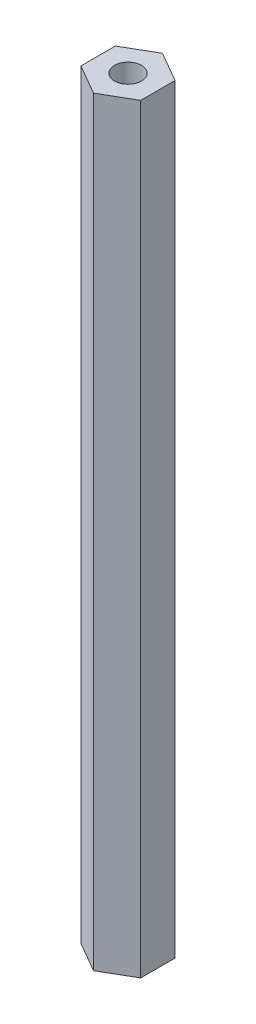
from build123d import *

# Parameters (mm, degrees)
BOSS_EXTRUDE1_DEPTH       = 70
M3X0_5_TAPPED_HOLE1_D     = 2.5
M3X0_5_TAPPED_HOLE1_DEPTH = 7.5
M3X0_5_TAPPED_HOLE1_TIP   = 0.751075774
M3X0_5_TAPPED_HOLE2_D     = 2.5
M3X0_5_TAPPED_HOLE2_DEPTH = 7.5
M3X0_5_TAPPED_HOLE2_TIP   = 0.751075774


with BuildPart() as part:
    # Sketch1 → Boss-Extrude1 (new body)
    with BuildSketch(Plane(origin=(0, 0, 0), x_dir=(1, 0, 0), z_dir=(0, 1, 0))):
        Polygon((-2.75, 1.58771324), (-2.75, -1.58771324), (0, -3.175426481), (2.75, -1.58771324), (2.75, 1.58771324), (0, 3.175426481), align=None)
    extrude(amount=BOSS_EXTRUDE1_DEPTH)

    # M3x0.5 Tapped Hole1
    with Locations(Plane(origin=(0, 0, 0), x_dir=(-1, 0, 0), z_dir=(0, -1, 0))):
        with Locations((0, 0)):
            Hole(M3X0_5_TAPPED_HOLE1_D / 2, depth=M3X0_5_TAPPED_HOLE1_DEPTH)
            with Locations((0, 0, -(M3X0_5_TAPPED_HOLE1_DEPTH + M3X0_5_TAPPED_HOLE1_TIP / 2))):  # 118° drill point
                Cone(0, M3X0_5_TAPPED_HOLE1_D / 2, M3X0_5_TAPPED_HOLE1_TIP, mode=Mode.SUBTRACT)

    # M3x0.5 Tapped Hole2
    with Locations(Plane(origin=(0, 70, 0), x_dir=(1, 0, 0), z_dir=(0, 1, 0))):
        with Locations((0, 0)):
            Hole(M3X0_5_TAPPED_HOLE2_D / 2, depth=M3X0_5_TAPPED_HOLE2_DEPTH)
            with Locations((0, 0, -(M3X0_5_TAPPED_HOLE2_DEPTH + M3X0_5_TAPPED_HOLE2_TIP / 2))):  # 118° drill point
                Cone(0, M3X0_5_TAPPED_HOLE2_D / 2, M3X0_5_TAPPED_HOLE2_TIP, mode=Mode.SUBTRACT)


solid = part.part
